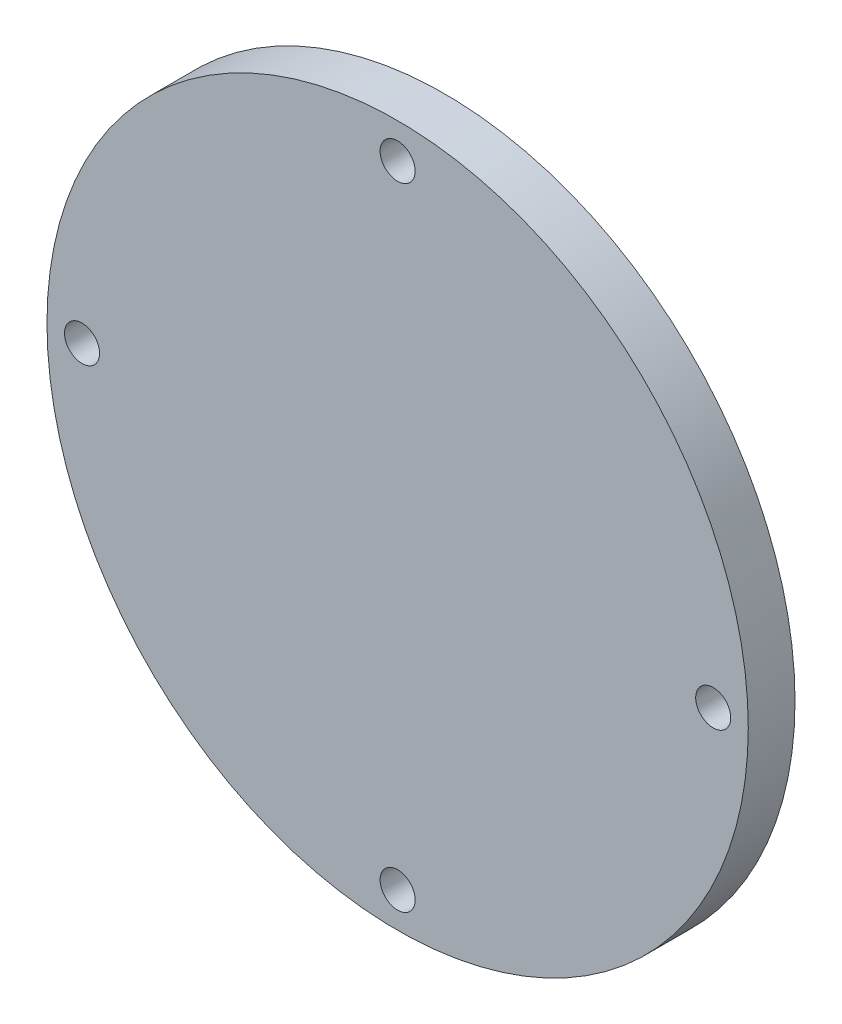
from build123d import *

# Parameters (mm, degrees)
SKETCH_1_R               = 30
EXTRUDE_1_DEPTH          = 4
SKETCH_3_R               = 1.5
CUT_EXTRUDE_1_DEPTH      = 10
PATTERN_CIRCULAR_1_COUNT = 4
SKETCH_4_R               = 16
SKETCH_4_R_2             = 12.5
EXTRUDE_2_DEPTH          = 6


with BuildPart() as part:
    # 草图1 → 凸台-拉伸1 (new body)
    with BuildSketch(Plane.XY):
        Circle(SKETCH_1_R)
    extrude(amount=EXTRUDE_1_DEPTH)

    # 草图3 → 切除-拉伸1 (cut)
    with BuildSketch(Plane.XY.offset(4)):
        with Locations((0, 27)):
            Circle(SKETCH_3_R)
    cut_extrude_1 = extrude(amount=-CUT_EXTRUDE_1_DEPTH, mode=Mode.SUBTRACT)

    # 阵列(圆周)1: 切除-拉伸1 ×4 about axis
    pattern_circular_1_axis = Axis((0, 0, 0), (0, 0, 1))
    for i in range(1, PATTERN_CIRCULAR_1_COUNT):
        add(cut_extrude_1.rotate(pattern_circular_1_axis, i * 360 / PATTERN_CIRCULAR_1_COUNT), mode=Mode.SUBTRACT)

    # 草图4 → 凸台-拉伸2 (add)
    with BuildSketch(Plane(origin=(0, 0, 0), x_dir=(-1, 0, 0), z_dir=(0, 0, -1))):
        with Locations(Location((0, 0, 0), (0, 0, 180))):
            Circle(SKETCH_4_R)
        Circle(SKETCH_4_R_2, mode=Mode.SUBTRACT)
    extrude(amount=EXTRUDE_2_DEPTH)


solid = part.part
